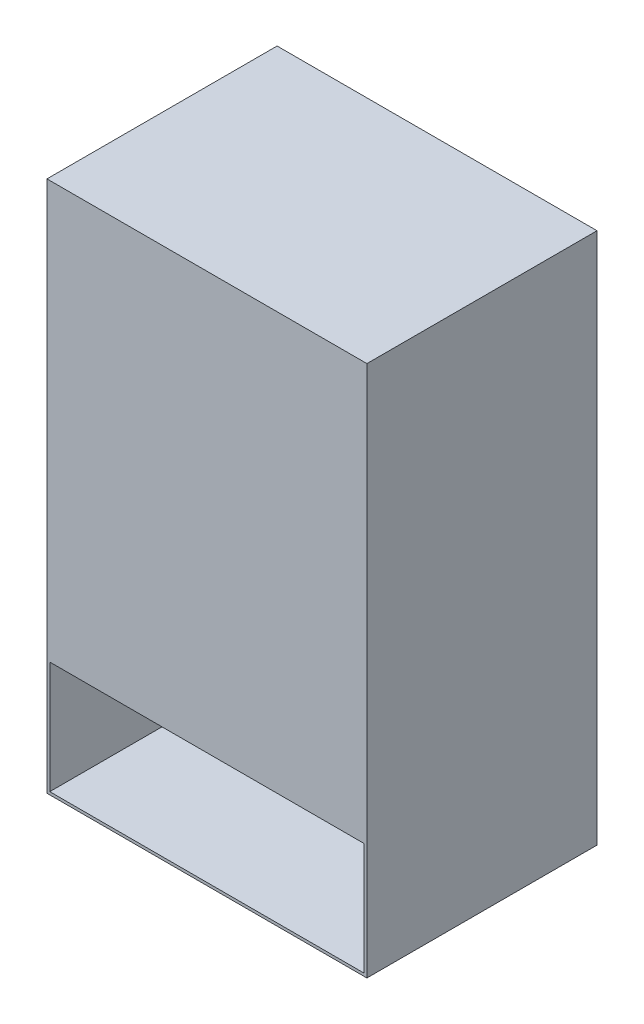
from build123d import *

# Parameters (mm, degrees)
ESQUISSE1_W             = 361.95
ESQUISSE1_H             = 601.98
BOSS_EXTRU_1_DEPTH      = 130.175
ESQUISSE3_W             = 355.6
ESQUISSE3_H             = 127
ENL_V_MAT_EXTRU_2_DEPTH = 3.175
ESQUISSE4_W             = 355.6
ESQUISSE4_H             = 595.63
ENL_V_MAT_EXTRU_3_DEPTH = 127
ESQUISSE5_W             = 355.6
ESQUISSE5_H             = 127
ENL_V_MAT_EXTRU_4_DEPTH = 3.175


with BuildPart() as part:
    # Esquisse1 → Boss.-Extru.1 (new, symmetric)
    with BuildSketch(Plane.XY):
        Rectangle(ESQUISSE1_W, ESQUISSE1_H)
    extrude(amount=BOSS_EXTRU_1_DEPTH, both=True)

    # Esquisse3 → Enlèv. mat.-Extru.2 (cut)
    with BuildSketch(Plane.XY.offset(130.175)):
        with Locations((0, -234.315)):
            Rectangle(ESQUISSE3_W, ESQUISSE3_H)
    extrude(amount=-ENL_V_MAT_EXTRU_2_DEPTH, mode=Mode.SUBTRACT)

    # Esquisse4 → Enlèv. mat.-Extru.3 (cut, symmetric)
    with BuildSketch(Plane.XY):
        Rectangle(ESQUISSE4_W, ESQUISSE4_H)
    extrude(amount=ENL_V_MAT_EXTRU_3_DEPTH, both=True, mode=Mode.SUBTRACT)

    # Esquisse5 → Enlèv. mat.-Extru.4 (cut)
    with BuildSketch(Plane(origin=(0, 0, -130.175), x_dir=(-1, 0, 0), z_dir=(0, 0, -1))):
        with Locations((0, 234.315)):
            Rectangle(ESQUISSE5_W, ESQUISSE5_H)
    extrude(amount=-ENL_V_MAT_EXTRU_4_DEPTH, mode=Mode.SUBTRACT)


solid = part.part
